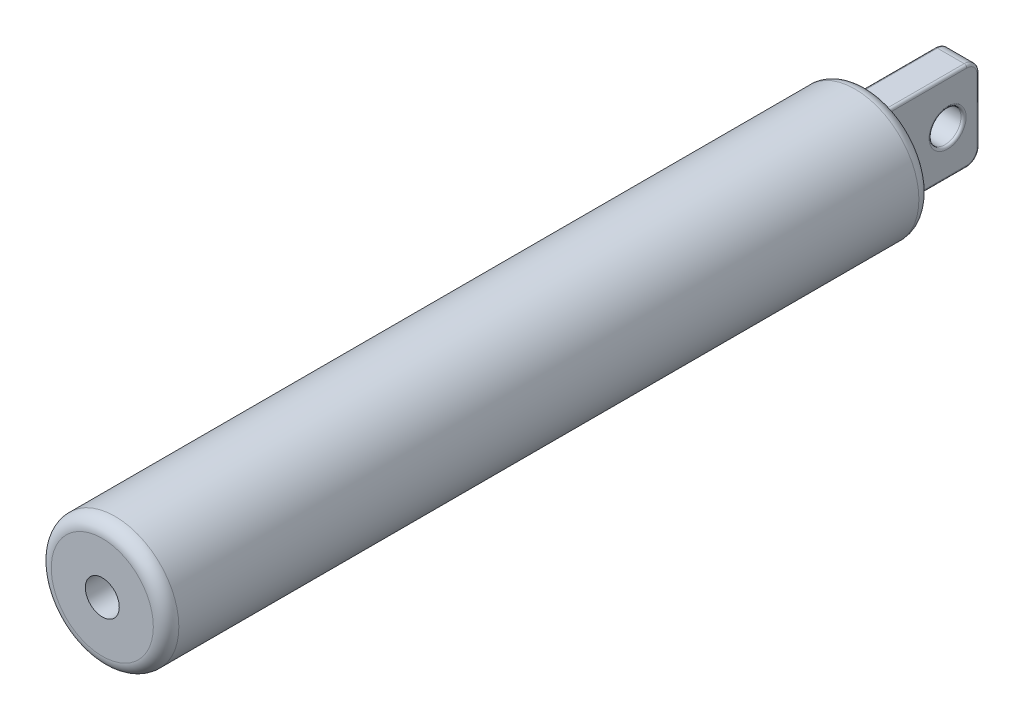
from build123d import *

# Parameters (mm, degrees)
SKETCH1_R                   = 12.7
EXTRUDE1_DEPTH              = 152.4
F_1_4_CLEARANCE_HOLE1_D     = 6.7564
F_1_4_CLEARANCE_HOLE1_DEPTH = 149.225
F_1_4_CLEARANCE_HOLE1_TIP   = 2.029827343
SKETCH4_W                   = 6.35
SKETCH4_H                   = 17.78
EXTRUDE2_DEPTH              = 19.05
SKETCH5_R                   = 3.175
EXTRUDE3_DEPTH              = 12.7
FILLET1_R                   = 2.54
FILLET2_R                   = 2.54
FILLET3_R                   = 0.508


with BuildPart() as part:
    # Sketch1 → Extrude1 (new body)
    with BuildSketch(Plane.XY):
        with Locations(Location((0, 0, 0), (0, 0, 180))):
            Circle(SKETCH1_R)
    extrude(amount=EXTRUDE1_DEPTH)

    # 1/4 Clearance Hole1
    with Locations(Plane.XY.offset(152.4)):
        with Locations((0, 0)):
            Hole(F_1_4_CLEARANCE_HOLE1_D / 2, depth=F_1_4_CLEARANCE_HOLE1_DEPTH)
            with Locations((0, 0, -(F_1_4_CLEARANCE_HOLE1_DEPTH + F_1_4_CLEARANCE_HOLE1_TIP / 2))):  # 118° drill point
                Cone(0, F_1_4_CLEARANCE_HOLE1_D / 2, F_1_4_CLEARANCE_HOLE1_TIP, mode=Mode.SUBTRACT)

    # Sketch4 → Extrude2 (add)
    with BuildSketch(Plane(origin=(0, 0, 0), x_dir=(-1, 0, 0), z_dir=(0, 0, -1))):
        Rectangle(SKETCH4_W, SKETCH4_H)
    extrude(amount=EXTRUDE2_DEPTH)

    # Sketch5 → Extrude3 (cut, symmetric)
    with BuildSketch(Plane(origin=(0, 0, 0), x_dir=(0, 0, -1), z_dir=(1, 0, 0))):
        with Locations((12.7, 0)):
            Circle(SKETCH5_R)
    extrude(amount=EXTRUDE3_DEPTH, both=True, mode=Mode.SUBTRACT)

    # Fillet1
    fillet1_edges = [part.edges().sort_by_distance(p)[0] for p in [
        (12.7, 0, 152.4),
    ]]
    fillet(fillet1_edges, radius=FILLET1_R)

    # Fillet2
    fillet2_edges = [part.edges().sort_by_distance(p)[0] for p in [
        (0, 8.89, -19.05),
        (0, -8.89, -19.05),
        (12.7, 0, 0),
    ]]
    fillet(fillet2_edges, radius=FILLET2_R)

    # Fillet3
    fillet3_edges = [part.edges().sort_by_distance(p)[0] for p in [
        (-3.175, 0, 0),
        (0, 8.89, 0),
        (3.175, 0, 0),
        (0, -8.89, 0),
        (3.175, 0, -9.525),
        (-3.175, 0, -9.525),
        (-3.175, 0, -19.05),
        (3.175, 0, -19.05),
        (-3.175, 8.89, -8.255),
        (-3.175, -8.89, -8.255),
        (-3.175, 8.146051224, -18.306051224),
        (-3.175, -8.146051224, -18.306051224),
        (3.175, -8.89, -8.255),
        (3.175, 8.89, -8.255),
        (3.175, 8.146051224, -18.306051224),
        (3.175, -8.146051224, -18.306051224),
    ]]
    fillet(fillet3_edges, radius=FILLET3_R)


solid = part.part
